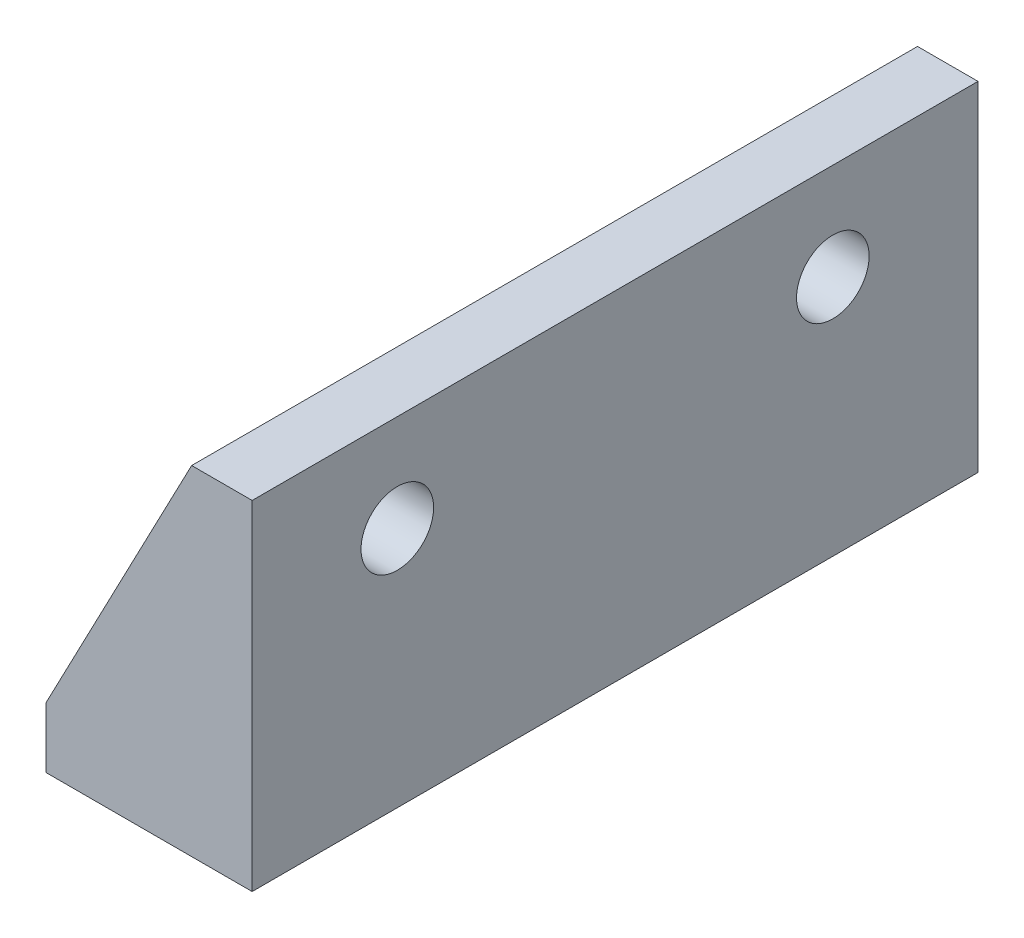
from build123d import *

# Parameters (mm, degrees)
EXTRUDE_1_DEPTH     = 15
SKETCH_3_R          = 1.5
CUT_EXTRUDE_1_DEPTH = 23.216894472
RIB_1_REACH         = 36.185
SKETCH_4_WALL_W     = 83.349688256
SKETCH_4_WALL_H     = 3
SKETCH_5_R          = 1.5
CUT_EXTRUDE_2_DEPTH = 23.216894472
FILLET_1_R          = 3


with BuildPart() as part:
    # 草图2 → 拉伸-薄壁1 (new, symmetric)
    with BuildSketch(Plane.XY):
        Polygon((0, 14), (0, 0), (-8.52, 0), (-8.52, 2.5), (-2.5, 2.5), (-2.5, 14), align=None)
    extrude(amount=EXTRUDE_1_DEPTH, both=True)

    # 草图3 → 切除-拉伸1 (cut, through all)
    with BuildSketch(Plane.XZ):
        with Locations((-5.52, 0)):
            Circle(SKETCH_3_R)
    extrude(amount=-CUT_EXTRUDE_1_DEPTH, mode=Mode.SUBTRACT)

    # 草图4 wall → 筋1 (add, up to next)
    with BuildSketch(Plane(origin=(-5.51, 8.25, 15), x_dir=(-0.463776683525, -0.885952136302, 0), z_dir=(0.885952136302, -0.463776683525, 0)), mode=Mode.PRIVATE) as rib_1_sk1:
        with Locations((0, 1.5)):
            Rectangle(SKETCH_4_WALL_W, SKETCH_4_WALL_H)
    rib_1_tool1 = extrude(rib_1_sk1.sketch, amount=RIB_1_REACH, mode=Mode.PRIVATE) - part.part
    rib_1 = rib_1_tool1.solids().sort_by_distance((-5.51, 8.25, 15))[0]
    add(rib_1)

    # 镜向1: 筋1 across plane
    add(rib_1.mirror(Plane.XY))

    # 草图5 → 切除-拉伸2 (cut, through all)
    with BuildSketch(Plane(origin=(0, 0, 0), x_dir=(0, 0, -1), z_dir=(1, 0, 0))):
        with Locations((-9, 10)):
            Circle(SKETCH_5_R)
        with Locations((9, 10)):
            Circle(SKETCH_5_R)
    extrude(amount=-CUT_EXTRUDE_2_DEPTH, mode=Mode.SUBTRACT)

    # 圆角1
    fillet_1_edges = [part.edges().sort_by_distance(p)[0] for p in [
        (-5.51, 2.5, 12),
        (-5.51, 2.5, -12),
    ]]
    fillet(fillet_1_edges, radius=FILLET_1_R)


solid = part.part
